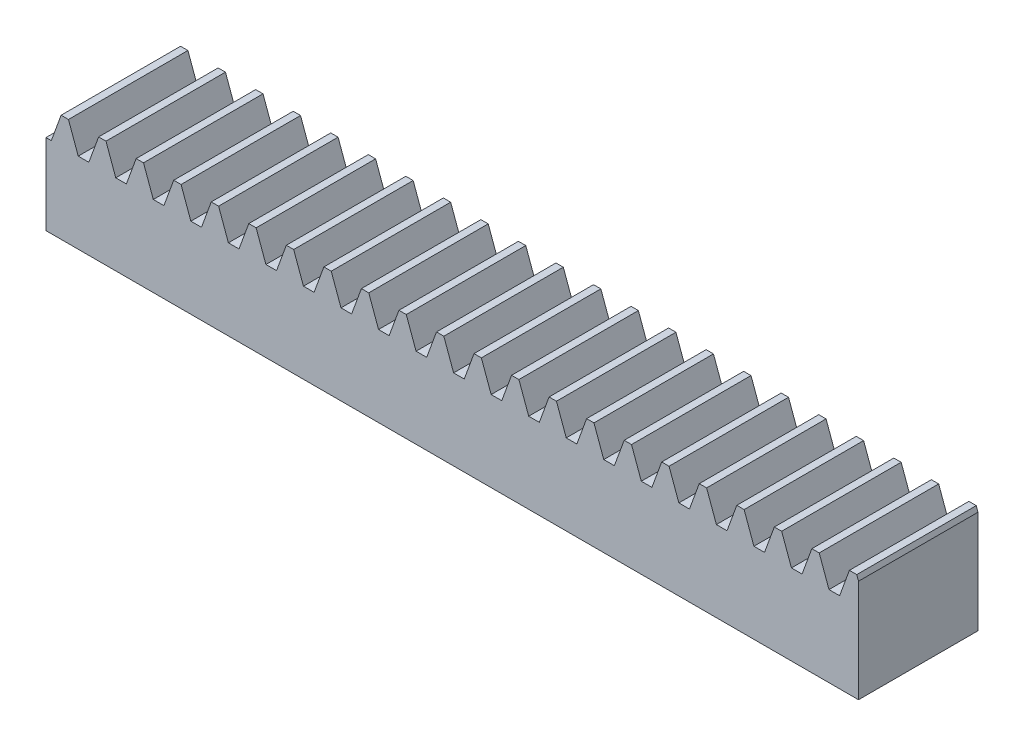
from build123d import *

# Parameters (mm, degrees)
BLANKSKE_W        = 34
BLANKSKE_H        = 4.5
BLANK_DEPTH       = 5
TOOTHCUTSIM_DEPTH = 35.659053651
TEETHCUTS_COUNT   = 23
TEETHCUTS_PITCH   = 1.570796325


with BuildPart() as part:
    # BlankSke → Blank (new body)
    with BuildSketch(Plane.XY):
        with Locations((17, 2.25)):
            Rectangle(BLANKSKE_W, BLANKSKE_H)
    extrude(amount=-BLANK_DEPTH)

    # TooCutSkeSim → ToothCutSim (cut, through all)
    with BuildSketch(Plane.XY):
        Polygon((0.222217685, 3.375), (-0.222217685, 3.375), (-0.640929042, 4.5254), (0.640929042, 4.5254), align=None)
    toothcutsim = extrude(amount=-TOOTHCUTSIM_DEPTH, mode=Mode.SUBTRACT)

    # TeethCuts: ToothCutSim ×23
    with Locations(*[(i * TEETHCUTS_PITCH, 0, 0) for i in range(1, TEETHCUTS_COUNT)]):
        add(toothcutsim, mode=Mode.SUBTRACT)


solid = part.part
